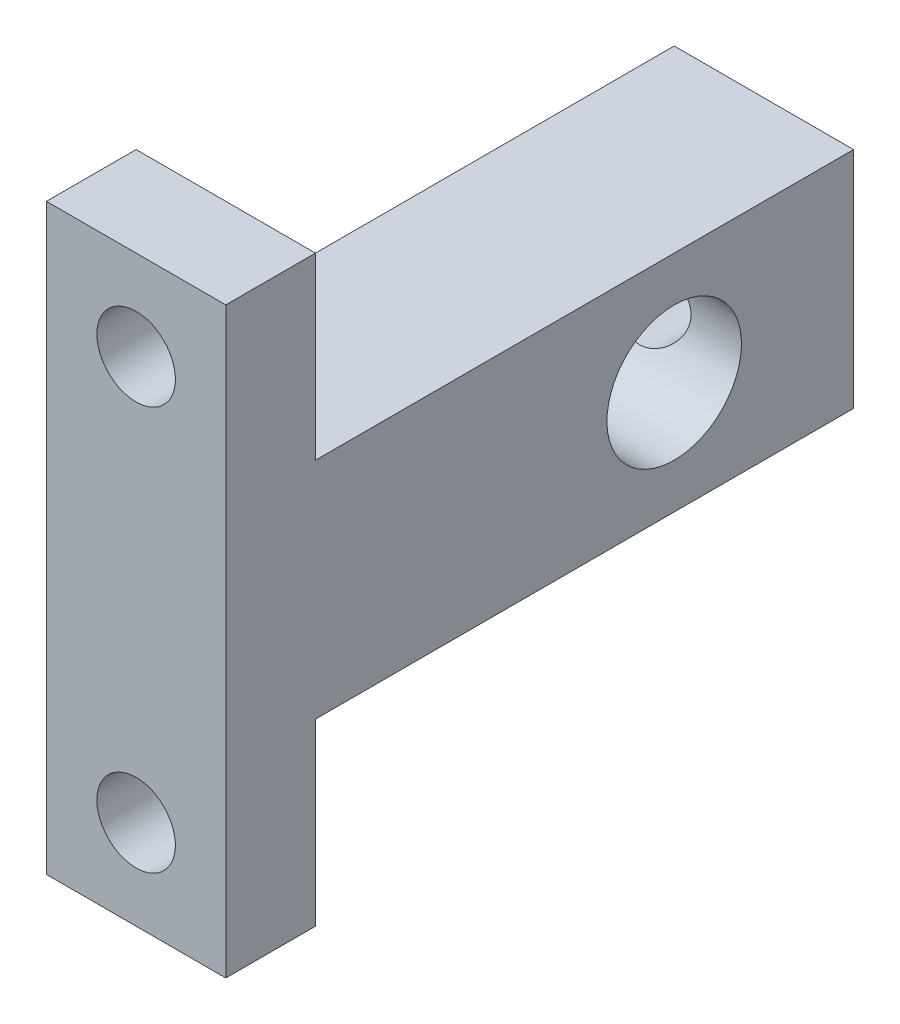
from build123d import *

# Parameters (mm, degrees)
SKETCH1_W               = 8
SKETCH1_H               = 26
BOSS_EXTRUDE1_DEPTH     = 4
SKETCH2_R               = 1.75
CUT_EXTRUDE1_DEPTH      = 4
SKETCH3_W               = 8
SKETCH3_H               = 10
BOSS_EXTRUDE2_DEPTH     = 24
SKETCH4_R               = 3
CUT_EXTRUDE2_DEPTH      = 20
CUT_EXTRUDE3_REACH      = 33.129
CUT_EXTRUDE3_END_RADIUS = 3
SKETCH5_R               = 1.75


with BuildPart() as part:
    # Sketch1 → Boss-Extrude1 (new body)
    with BuildSketch(Plane.XY):
        Rectangle(SKETCH1_W, SKETCH1_H)
    extrude(amount=BOSS_EXTRUDE1_DEPTH)

    # Sketch2 → Cut-Extrude1 (cut)
    with BuildSketch(Plane(origin=(0, 0, 0), x_dir=(-1, 0, 0), z_dir=(0, 0, -1))):
        with Locations((0, 9)):
            Circle(SKETCH2_R)
        with Locations((0, -9)):
            Circle(SKETCH2_R)
    extrude(amount=-CUT_EXTRUDE1_DEPTH, mode=Mode.SUBTRACT)

    # Sketch3 → Boss-Extrude2 (add)
    with BuildSketch(Plane(origin=(0, 0, 0), x_dir=(-1, 0, 0), z_dir=(0, 0, -1))):
        Rectangle(SKETCH3_W, SKETCH3_H)
    extrude(amount=BOSS_EXTRUDE2_DEPTH)

    # Sketch4 → Cut-Extrude2 (cut)
    with BuildSketch(Plane(origin=(4, 0, 0), x_dir=(0, 0, -1), z_dir=(1, 0, 0))):
        with Locations(Location((16, 0, 0), (0, 0, 90))):
            Circle(SKETCH4_R)
    extrude(amount=-CUT_EXTRUDE2_DEPTH, mode=Mode.SUBTRACT)

    # Cut-Extrude3: up to this cylinder (the profile starts outside it)
    cut_extrude3_end = Plane(origin=(0, 0, -16), z_dir=(1, 0, 0)) * Cylinder(CUT_EXTRUDE3_END_RADIUS, 73.258, mode=Mode.PRIVATE)
    # Sketch5 → Cut-Extrude3 (cut, up to the surface)
    with BuildSketch(Plane(origin=(0, 0, -24), x_dir=(-1, 0, 0), z_dir=(0, 0, -1)), mode=Mode.PRIVATE) as cut_extrude3_sk1:
        Circle(SKETCH5_R)
    cut_extrude3_tool1 = extrude(cut_extrude3_sk1.sketch, amount=-CUT_EXTRUDE3_REACH, mode=Mode.PRIVATE) - cut_extrude3_end
    add(cut_extrude3_tool1.solids().sort_by_distance((0, 0, -24))[0], mode=Mode.SUBTRACT)


solid = part.part
